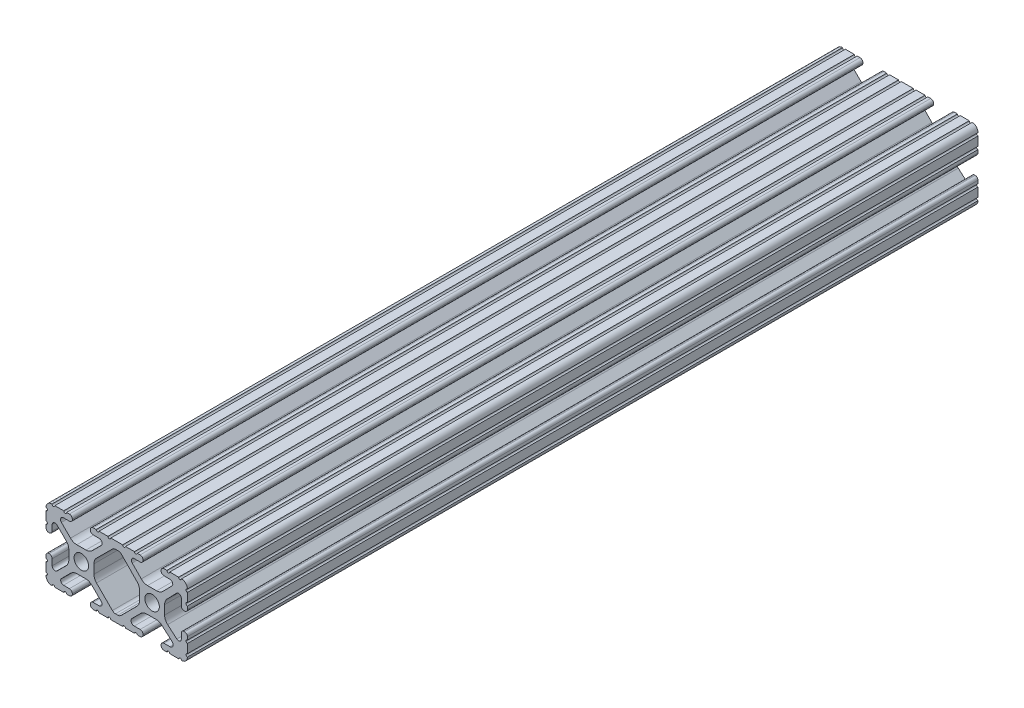
from build123d import *

# Parameters (mm, degrees)
SKETCH1_R           = 2.6035
BOSS_EXTRUDE1_DEPTH = 141.987599946


with BuildPart() as part:
    # Sketch1 → Boss-Extrude1 (new, symmetric)
    with BuildSketch(Plane.XY):
        with BuildLine():
            Line((18.01710265, 12.7), (16.98745015, 12.7))
            ThreePointArc((16.98745015, 12.7), (16.245730386, 12.392769614), (15.9385, 11.65104985))
            Line((15.9385, 11.65104985), (15.9385, 11.53922))
            ThreePointArc((15.9385, 11.53922), (16.245750844, 10.797450844), (16.98752, 10.4902))
            Line((16.98752, 10.4902), (19.116384363, 10.4902))
            ThreePointArc((19.116384363, 10.4902), (20.052502933, 9.869096983), (19.844087081, 8.765172272))
            Line((19.844087081, 8.765172272), (16.618993479, 5.455112286))
            ThreePointArc((16.618993479, 5.455112286), (15.578994274, 4.745442459), (14.344932584, 4.4958))
            Line((14.344932584, 4.4958), (11.083317835, 4.4958))
            ThreePointArc((11.083317835, 4.4958), (9.854330953, 4.743306833), (8.816955189, 5.447238587))
            Line((8.816955189, 5.447238587), (5.564154119, 8.762652677))
            ThreePointArc((5.564154119, 8.762652677), (5.352591412, 9.867473037), (6.289393385, 10.4902))
            Line((6.289393385, 10.4902), (8.41248, 10.4902))
            ThreePointArc((8.41248, 10.4902), (9.154249156, 10.797450844), (9.4615, 11.53922))
            Line((9.4615, 11.53922), (9.4615, 11.65104985))
            ThreePointArc((9.4615, 11.65104985), (9.154269614, 12.392769614), (8.41254985, 12.7))
            Line((8.41254985, 12.7), (7.38288465, 12.7))
            ThreePointArc((7.38288465, 12.7), (6.87488465, 12.192), (6.36688465, 12.7))
            Line((6.36688465, 12.7), (3.14958095, 12.7))
            ThreePointArc((3.14958095, 12.7), (2.64158095, 12.192), (2.13358095, 12.7))
            Line((2.13358095, 12.7), (-2.13358095, 12.7))
            ThreePointArc((-2.13358095, 12.7), (-2.64158095, 12.192), (-3.14958095, 12.7))
            Line((-3.14958095, 12.7), (-6.36689735, 12.7))
            ThreePointArc((-6.36689735, 12.7), (-6.87489735, 12.192), (-7.38289735, 12.7))
            Line((-7.38289735, 12.7), (-8.41254985, 12.7))
            ThreePointArc((-8.41254985, 12.7), (-9.154269614, 12.392769614), (-9.4615, 11.65104985))
            Line((-9.4615, 11.65104985), (-9.4615, 11.53922))
            ThreePointArc((-9.4615, 11.53922), (-9.154249156, 10.797450844), (-8.41248, 10.4902))
            Line((-8.41248, 10.4902), (-6.283641037, 10.4902))
            ThreePointArc((-6.283641037, 10.4902), (-5.297291557, 9.829633109), (-5.532576693, 8.666071843))
            Line((-5.532576693, 8.666071843), (-8.809985098, 5.416263103))
            ThreePointArc((-8.809985098, 5.416263103), (-9.836720513, 4.734920264), (-11.045536121, 4.4958))
            Line((-11.045536121, 4.4958), (-14.354463879, 4.4958))
            ThreePointArc((-14.354463879, 4.4958), (-15.563279487, 4.734920264), (-16.590014902, 5.416263103))
            Line((-16.590014902, 5.416263103), (-19.867423307, 8.666071843))
            ThreePointArc((-19.867423307, 8.666071843), (-20.102708443, 9.829633109), (-19.116358963, 10.4902))
            Line((-19.116358963, 10.4902), (-16.98752, 10.4902))
            ThreePointArc((-16.98752, 10.4902), (-16.245750844, 10.797450844), (-15.9385, 11.53922))
            Line((-15.9385, 11.53922), (-15.9385, 11.65104985))
            ThreePointArc((-15.9385, 11.65104985), (-16.245730386, 12.392769614), (-16.98745015, 12.7))
            Line((-16.98745015, 12.7), (-18.01711535, 12.7))
            ThreePointArc((-18.01711535, 12.7), (-18.52511535, 12.192), (-19.03311535, 12.7))
            Line((-19.03311535, 12.7), (-22.2504, 12.7))
            ThreePointArc((-22.2504, 12.7), (-22.758323491, 12.192000006), (-23.266399977, 12.699846982))
            ThreePointArc((-23.266399977, 12.699846982), (-24.782522516, 12.082522516), (-25.399846982, 10.566399977))
            ThreePointArc((-25.399846982, 10.566399977), (-24.892000006, 10.058323491), (-25.4, 9.5504))
            Line((-25.4, 9.5504), (-25.4, 6.3330836))
            ThreePointArc((-25.4, 6.3330836), (-24.892, 5.8250836), (-25.4, 5.3170836))
            Line((-25.4, 5.3170836), (-25.4, 4.237520184))
            ThreePointArc((-25.4, 4.237520184), (-25.107393763, 3.531106237), (-24.400979816, 3.2385))
            Line((-24.400979816, 3.2385), (-24.23922, 3.2385))
            ThreePointArc((-24.23922, 3.2385), (-23.497450844, 3.545750844), (-23.1902, 4.28752))
            Line((-23.1902, 4.28752), (-23.1902, 6.334741132))
            ThreePointArc((-23.1902, 6.334741132), (-22.556026952, 7.286023527), (-21.434002553, 7.066535717))
            Line((-21.434002553, 7.066535717), (-18.147950853, 3.808156468))
            ThreePointArc((-18.147950853, 3.808156468), (-17.452759693, 2.774838327), (-17.208501877, 1.553619571))
            Line((-17.208501877, 1.553619571), (-17.208501877, -1.695179196))
            ThreePointArc((-17.208501877, -1.695179196), (-17.450738657, -2.911536421), (-18.140486065, -3.942289578))
            Line((-18.140486065, -3.942289578), (-21.431579576, -7.227386226))
            ThreePointArc((-21.431579576, -7.227386226), (-22.55444896, -7.449940594), (-23.1902, -6.498002195))
            Line((-23.1902, -6.498002195), (-23.1902, -4.28752))
            ThreePointArc((-23.1902, -4.28752), (-23.497450844, -3.545750844), (-24.23922, -3.2385))
            Line((-24.23922, -3.2385), (-24.35098, -3.2385))
            ThreePointArc((-24.35098, -3.2385), (-25.092749156, -3.545750844), (-25.4, -4.28752))
            Line((-25.4, -4.28752), (-25.4, -5.3171344))
            ThreePointArc((-25.4, -5.3171344), (-24.892, -5.8251344), (-25.4, -6.3331344))
            Line((-25.4, -6.3331344), (-25.4, -9.5504))
            ThreePointArc((-25.4, -9.5504), (-24.892000006, -10.058323491), (-25.399846982, -10.566399977))
            ThreePointArc((-25.399846982, -10.566399977), (-24.782522516, -12.082522516), (-23.266399977, -12.699846982))
            ThreePointArc((-23.266399977, -12.699846982), (-22.758323491, -12.192000006), (-22.2504, -12.7))
            Line((-22.2504, -12.7), (-19.03308995, -12.7))
            ThreePointArc((-19.03308995, -12.7), (-18.52508995, -12.192), (-18.01708995, -12.7))
            Line((-18.01708995, -12.7), (-16.9874692, -12.7))
            ThreePointArc((-16.9874692, -12.7), (-16.245700044, -12.392749156), (-15.9384492, -11.65098))
            Line((-15.9384492, -11.65098), (-15.9384492, -11.53922))
            ThreePointArc((-15.9384492, -11.53922), (-16.245700044, -10.797450844), (-16.9874692, -10.4902))
            Line((-16.9874692, -10.4902), (-19.116358963, -10.4902))
            ThreePointArc((-19.116358963, -10.4902), (-20.055197748, -9.862578342), (-19.834124023, -8.755124678))
            Line((-19.834124023, -8.755124678), (-16.49660751, -5.423689618))
            ThreePointArc((-16.49660751, -5.423689618), (-15.467274017, -4.736928798), (-14.253591699, -4.4958))
            Line((-14.253591699, -4.4958), (-11.146408301, -4.4958))
            ThreePointArc((-11.146408301, -4.4958), (-9.932725983, -4.736928798), (-8.90339249, -5.423689618))
            Line((-8.90339249, -5.423689618), (-5.565875977, -8.755124678))
            ThreePointArc((-5.565875977, -8.755124678), (-5.344802252, -9.862578342), (-6.283641037, -10.4902))
            Line((-6.283641037, -10.4902), (-8.4125308, -10.4902))
            ThreePointArc((-8.4125308, -10.4902), (-9.154299956, -10.797450844), (-9.4615508, -11.53922))
            Line((-9.4615508, -11.53922), (-9.4615508, -11.65098))
            ThreePointArc((-9.4615508, -11.65098), (-9.154299956, -12.392749156), (-8.4125308, -12.7))
            Line((-8.4125308, -12.7), (-7.38287195, -12.7))
            ThreePointArc((-7.38287195, -12.7), (-6.87487195, -12.192), (-6.36687195, -12.7))
            Line((-6.36687195, -12.7), (-3.14960635, -12.7))
            ThreePointArc((-3.14960635, -12.7), (-2.64160635, -12.192), (-2.13360635, -12.7))
            Line((-2.13360635, -12.7), (2.13360635, -12.7))
            ThreePointArc((2.13360635, -12.7), (2.64159365, -12.1920127), (3.14958095, -12.7))
            Line((3.14958095, -12.7), (6.36691005, -12.7))
            ThreePointArc((6.36691005, -12.7), (6.87491005, -12.192), (7.38291005, -12.7))
            Line((7.38291005, -12.7), (8.4125308, -12.7))
            ThreePointArc((8.4125308, -12.7), (9.154299956, -12.392749156), (9.4615508, -11.65098))
            Line((9.4615508, -11.65098), (9.4615508, -11.53922))
            ThreePointArc((9.4615508, -11.53922), (9.154299956, -10.797450844), (8.4125308, -10.4902))
            Line((8.4125308, -10.4902), (6.289393385, -10.4902))
            ThreePointArc((6.289393385, -10.4902), (5.231590322, -9.783049717), (5.480677245, -8.535265862))
            Line((5.480677245, -8.535265862), (8.597933595, -5.423689618))
            ThreePointArc((8.597933595, -5.423689618), (9.627267088, -4.736928798), (10.840949406, -4.4958))
            Line((10.840949406, -4.4958), (14.102564155, -4.4958))
            ThreePointArc((14.102564155, -4.4958), (15.215927525, -4.697410182), (16.187895372, -5.276636531))
            Line((16.187895372, -5.276636531), (19.868247549, -8.482246082))
            ThreePointArc((19.868247549, -8.482246082), (20.188435806, -9.746879864), (19.116384363, -10.4902))
            Line((19.116384363, -10.4902), (16.9874692, -10.4902))
            ThreePointArc((16.9874692, -10.4902), (16.245700044, -10.797450844), (15.9384492, -11.53922))
            Line((15.9384492, -11.53922), (15.9384492, -11.65098))
            ThreePointArc((15.9384492, -11.65098), (16.245700044, -12.392749156), (16.9874692, -12.7))
            Line((16.9874692, -12.7), (18.01710265, -12.7))
            ThreePointArc((18.01710265, -12.7), (18.52510265, -12.192), (19.03310265, -12.7))
            Line((19.03310265, -12.7), (22.2504, -12.7))
            ThreePointArc((22.2504, -12.7), (22.758323491, -12.192000006), (23.266399977, -12.699846982))
            ThreePointArc((23.266399977, -12.699846982), (24.782522516, -12.082522516), (25.399846982, -10.566399977))
            ThreePointArc((25.399846982, -10.566399977), (24.892000006, -10.058323492), (25.4, -9.550400001))
            Line((25.4, -9.550400001), (25.4, -6.333083592))
            ThreePointArc((25.4, -6.333083592), (24.892000001, -5.825083593), (25.4, -5.317083593))
            Line((25.4, -5.317083593), (25.4, -4.237520184))
            ThreePointArc((25.4, -4.237520184), (25.107393763, -3.531106237), (24.400979816, -3.2385))
            Line((24.400979816, -3.2385), (24.189220184, -3.2385))
            ThreePointArc((24.189220184, -3.2385), (23.482806237, -3.531106237), (23.1902, -4.237520184))
            Line((23.1902, -4.237520184), (23.1902, -6.155876159))
            ThreePointArc((23.1902, -6.155876159), (22.62232736, -7.038258539), (21.583974541, -6.886926384))
            Line((21.583974541, -6.886926384), (18.29817066, -4.024970844))
            ThreePointArc((18.29817066, -4.024970844), (17.493730985, -2.946044689), (17.208501877, -1.630807374))
            Line((17.208501877, -1.630807374), (17.208501877, 1.630807374))
            ThreePointArc((17.208501877, 1.630807374), (17.442348332, 2.82673414), (18.109440981, 3.846495088))
            Line((18.109440981, 3.846495088), (21.526346532, 7.353420386))
            ThreePointArc((21.526346532, 7.353420386), (22.585896263, 7.574939077), (23.1902, 6.676867167))
            Line((23.1902, 6.676867167), (23.1902, 4.237520184))
            ThreePointArc((23.1902, 4.237520184), (23.482806237, 3.531106237), (24.189220184, 3.2385))
            Line((24.189220184, 3.2385), (24.400979816, 3.2385))
            ThreePointArc((24.400979816, 3.2385), (25.107393763, 3.531106237), (25.4, 4.237520184))
            Line((25.4, 4.237520184), (25.4, 5.3170836))
            ThreePointArc((25.4, 5.3170836), (24.891949193, 5.825134407), (25.4, 6.333185215))
            Line((25.4, 6.333185215), (25.4, 9.550400015))
            ThreePointArc((25.4, 9.550400015), (24.892000013, 10.058323498), (25.399846982, 10.566399977))
            ThreePointArc((25.399846982, 10.566399977), (24.782522516, 12.082522516), (23.266399977, 12.699846982))
            ThreePointArc((23.266399977, 12.699846982), (22.758323491, 12.192000006), (22.2504, 12.7))
            Line((22.2504, 12.7), (19.03310265, 12.7))
            ThreePointArc((19.03310265, 12.7), (18.52510265, 12.192), (18.01710265, 12.7))
        make_face()
        with Locations((-12.7, 0)):
            Circle(SKETCH1_R, mode=Mode.SUBTRACT)
        with Locations((12.7, 0)):
            Circle(SKETCH1_R, mode=Mode.SUBTRACT)
        with BuildLine():
            Line((-7.259513935, -3.869413038), (-1.545748891, -9.572766749))
            ThreePointArc((-1.545748891, -9.572766749), (-1.035199478, -9.913400116), (-0.433213048, -10.033))
            Line((-0.433213048, -10.033), (0.433213048, -10.033))
            ThreePointArc((0.433213048, -10.033), (1.035199478, -9.913400116), (1.545748891, -9.572766749))
            Line((1.545748891, -9.572766749), (7.259513935, -3.869413038))
            ThreePointArc((7.259513935, -3.869413038), (7.949261343, -2.838659881), (8.191498123, -1.622302656))
            Line((8.191498123, -1.622302656), (8.191498123, 1.622302656))
            ThreePointArc((8.191498123, 1.622302656), (7.955573352, 2.823327967), (7.282860769, 3.845864069))
            Line((7.282860769, 3.845864069), (1.675572808, 9.561086461))
            ThreePointArc((1.675572808, 9.561086461), (1.161034429, 9.910236611), (0.551456936, 10.033))
            Line((0.551456936, 10.033), (-0.395199982, 10.033))
            ThreePointArc((-0.395199982, 10.033), (-0.994772524, 9.914396349), (-1.50403329, 9.576450301))
            Line((-1.50403329, 9.576450301), (-7.252049147, 3.876839553))
            ThreePointArc((-7.252049147, 3.876839553), (-7.947240307, 2.843521412), (-8.191498123, 1.622302656))
            Line((-8.191498123, 1.622302656), (-8.191498123, -1.622302656))
            ThreePointArc((-8.191498123, -1.622302656), (-7.949261343, -2.838659881), (-7.259513935, -3.869413038))
        make_face(mode=Mode.SUBTRACT)
    extrude(amount=BOSS_EXTRUDE1_DEPTH, both=True)


solid = part.part
